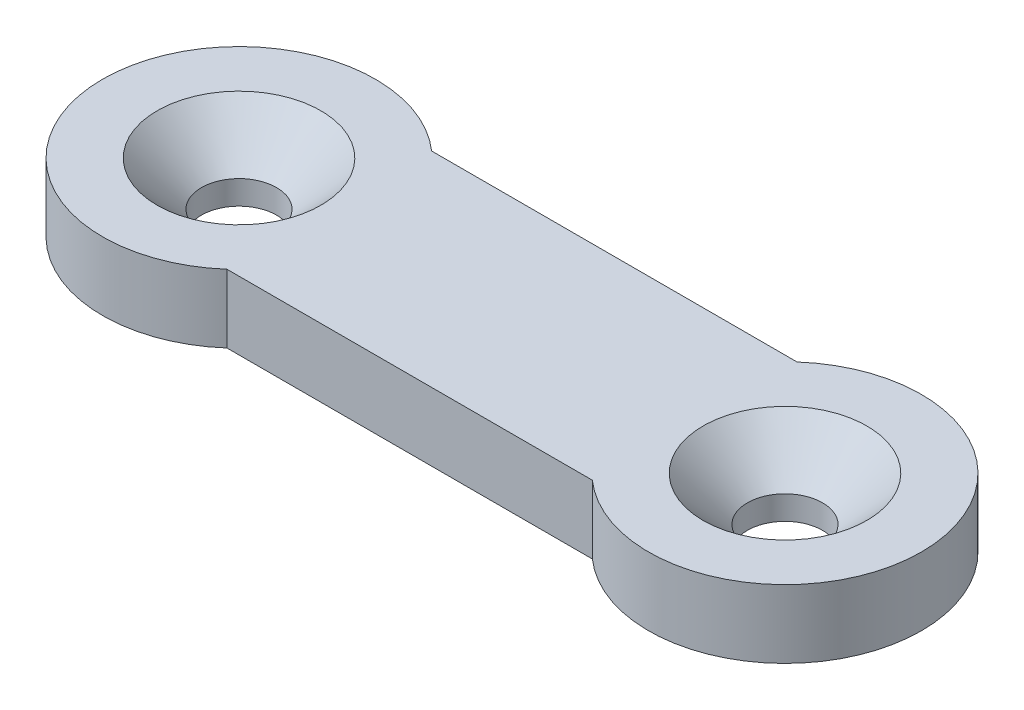
from build123d import *

# Parameters (mm, degrees)
SKETCH1_R           = 1.1
BOSS_EXTRUDE1_DEPTH = 2
BOSS_EXTRUDE3_START = -2
SKETCH3_R           = 4
SKETCH3_R_2         = 1.1
BOSS_EXTRUDE3_DEPTH = 2
CHAMFER1_SIZE       = 1.3


with BuildPart() as part:
    # Sketch1 → Boss-Extrude1 (new body)
    with BuildSketch(Plane(origin=(0, 0, 0), x_dir=(1, 0, 0), z_dir=(0, 1, 0))):
        with BuildLine():
            Line((-8, 3), (8, 3))
            ThreePointArc((8, 3), (11, 0), (8, -3))
            Line((8, -3), (-8, -3))
            ThreePointArc((-8, -3), (-11, 0), (-8, 3))
        make_face()
        with Locations(Location((-8, 0, 0), (0, 0, 270))):
            Circle(SKETCH1_R, mode=Mode.SUBTRACT)
        with Locations(Location((8, 0, 0), (0, 0, 270))):
            Circle(SKETCH1_R, mode=Mode.SUBTRACT)
    extrude(amount=BOSS_EXTRUDE1_DEPTH)

    # Sketch3 → Boss-Extrude3 (add)
    # profile 1 of 2: a face of its own
    with BuildSketch(Plane(origin=(0, 2, 0), x_dir=(1, 0, 0), z_dir=(0, 1, 0)).offset(BOSS_EXTRUDE3_START)):
        with Locations((-8, 0)):
            Circle(SKETCH3_R)
        with Locations(Location((-8, 0, 0), (0, 0, 270))):
            Circle(SKETCH3_R_2, mode=Mode.SUBTRACT)
    # profile 2 of 2: a face of its own
    with BuildSketch(Plane(origin=(0, 2, 0), x_dir=(1, 0, 0), z_dir=(0, 1, 0)).offset(BOSS_EXTRUDE3_START)):
        with Locations((8, 0)):
            Circle(SKETCH3_R)
        with Locations(Location((8, 0, 0), (0, 0, 270))):
            Circle(SKETCH3_R_2, mode=Mode.SUBTRACT)
    extrude(amount=BOSS_EXTRUDE3_DEPTH)

    # Chamfer1
    chamfer1_edges = [part.edges().sort_by_distance(p)[0] for p in [
        (-8, 2, -1.1),
        (8, 2, -1.1),
    ]]
    chamfer(chamfer1_edges, length=CHAMFER1_SIZE)


solid = part.part
